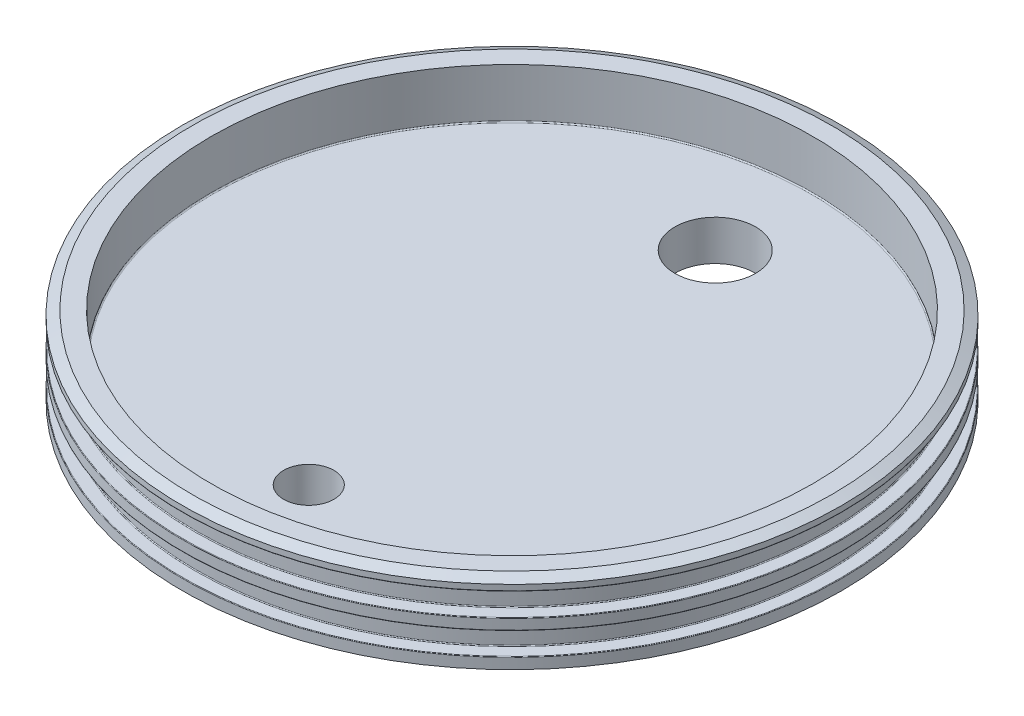
from build123d import *

# Parameters (mm, degrees)
SKETCH6_R                                = 66.04
BOSS_EXTRUDE1_DEPTH                      = 2.54
CNC_ID_FILLET_R                          = 0.1778
CNC_OD_FILLET_R                          = 0.127
CNC_CHAMFERS_SIZE                        = 1.016
CNC_CHAMFERS_SIZE2                       = 2.178819031
CNC_BORE_FILLET_R                        = 0.254
PIPE_TAP_DRILL_FOR_1_2_TAP_FILL_VALVE_D  = 17.8562
PIPE_TAP_DRILL_FOR_1_4_TAP_SOLENOID_VA_D = 11.1252


with BuildPart() as part:
    # Sketch1 → Revolve1 (revolve)
    with BuildSketch(Plane.XY, mode=Mode.PRIVATE) as revolve1_sk:
        Polygon((0, 0), (72.898, 0), (72.898, 2.4638), (69.977, 2.4638), (69.977, 7.4422), (72.898, 7.4422), (72.898, 9.906), (69.977, 9.906), (69.977, 14.986), (72.898, 14.986), (72.898, 17.3482), (66.548, 17.3482), (66.548, 6.35), (0, 6.35), align=None)
    revolve(revolve1_sk.sketch.rotate(Axis((0, 48.192213231, 0), (0, -1, 0)), 180), axis=Axis((0, 48.192213231, 0), (0, -1, 0)))

    # Sketch6 → Boss-Extrude1 (add)
    with BuildSketch(Plane.XZ):
        Circle(SKETCH6_R)
    extrude(amount=BOSS_EXTRUDE1_DEPTH)

    # CNC ID Fillet
    cnc_id_fillet_edges = [part.edges().sort_by_distance(p)[0] for p in [
        (69.977, 14.986, 0),
        (69.977, 9.906, 0),
        (69.977, 7.4422, 0),
        (69.977, 2.4638, 0),
        (-66.04, 0, 0),
    ]]
    fillet(cnc_id_fillet_edges, radius=CNC_ID_FILLET_R)

    # CNC OD Fillet
    cnc_od_fillet_edges = [part.edges().sort_by_distance(p)[0] for p in [
        (72.898, 14.986, 0),
        (72.898, 9.906, 0),
        (72.898, 7.4422, 0),
        (72.898, 2.4638, 0),
        (-66.04, -2.54, 0),
    ]]
    fillet(cnc_od_fillet_edges, radius=CNC_OD_FILLET_R)

    # CNC Chamfers
    cnc_chamfers_edges = [part.edges().sort_by_distance(p)[0] for p in [
        (72.898, 17.3482, 0),
    ]]
    cnc_chamfers_side = [part.faces().sort_by_distance(p)[0] for p in [
        (72.898, 16.2306, 0),
    ]]
    chamfer(cnc_chamfers_edges, length=CNC_CHAMFERS_SIZE, length2=CNC_CHAMFERS_SIZE2, reference=cnc_chamfers_side[0])

    # CNC Bore Fillet
    cnc_bore_fillet_edges = [part.edges().sort_by_distance(p)[0] for p in [
        (66.548, 6.35, 0),
    ]]
    fillet(cnc_bore_fillet_edges, radius=CNC_BORE_FILLET_R)

    # Pipe Tap Drill for 1/2 Tap - Fill Valve (through all)
    with Locations(Plane(origin=(0, -2.54, 0), x_dir=(-1, 0, 0), z_dir=(0, -1, 0))):
        with Locations((0, 44.958)):
            Hole(PIPE_TAP_DRILL_FOR_1_2_TAP_FILL_VALVE_D / 2)

    # Pipe Tap Drill for 1/4 Tap - Solenoid Valve (through all)
    with Locations(Plane(origin=(0, -2.54, 0), x_dir=(-1, 0, 0), z_dir=(0, -1, 0))):
        with Locations((0, -44.958)):
            Hole(PIPE_TAP_DRILL_FOR_1_4_TAP_SOLENOID_VA_D / 2)


solid = part.part
